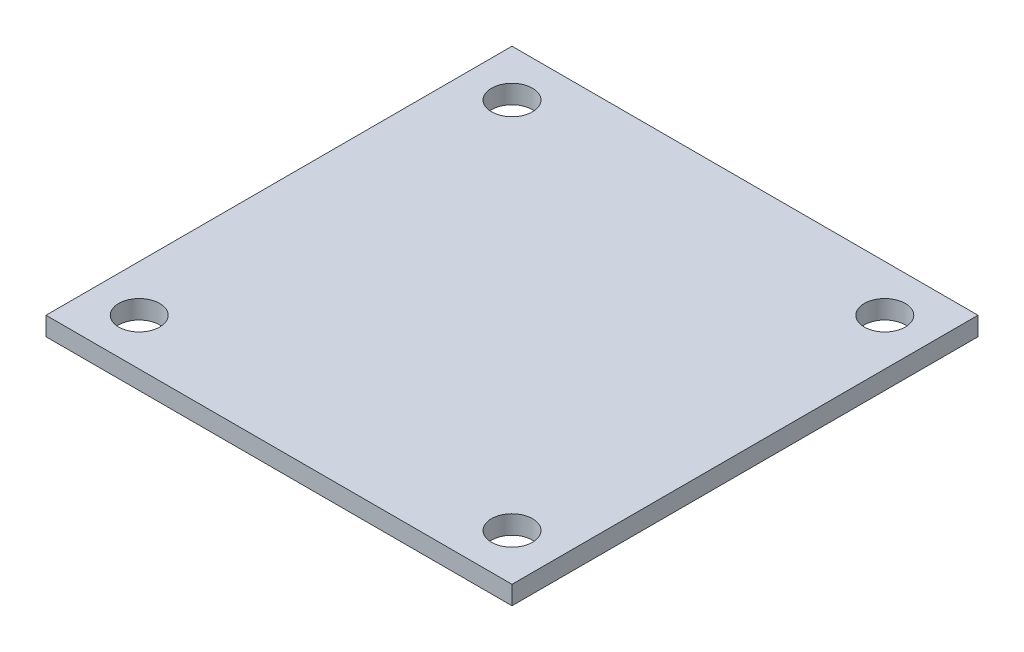
from build123d import *

# Parameters (mm, degrees)
SKETCH1_W           = 6350
SKETCH1_H           = 6350
SKETCH1_R           = 279.4
BOSS_EXTRUDE1_DEPTH = 254


with BuildPart() as part:
    # Sketch1 → Boss-Extrude1 (new body)
    with BuildSketch(Plane(origin=(0, 0, 0), x_dir=(1, 0, 0), z_dir=(0, 1, 0))):
        Rectangle(SKETCH1_W, SKETCH1_H)
        with Locations(Location((-2540, -2540, 0), (0, 0, 270))):
            Circle(SKETCH1_R, mode=Mode.SUBTRACT)
        with Locations(Location((-2540, 2540, 0), (0, 0, 270))):
            Circle(SKETCH1_R, mode=Mode.SUBTRACT)
        with Locations(Location((2540, 2540, 0), (0, 0, 270))):
            Circle(SKETCH1_R, mode=Mode.SUBTRACT)
        with Locations(Location((2540, -2540, 0), (0, 0, 270))):
            Circle(SKETCH1_R, mode=Mode.SUBTRACT)
    extrude(amount=BOSS_EXTRUDE1_DEPTH)


solid = part.part
